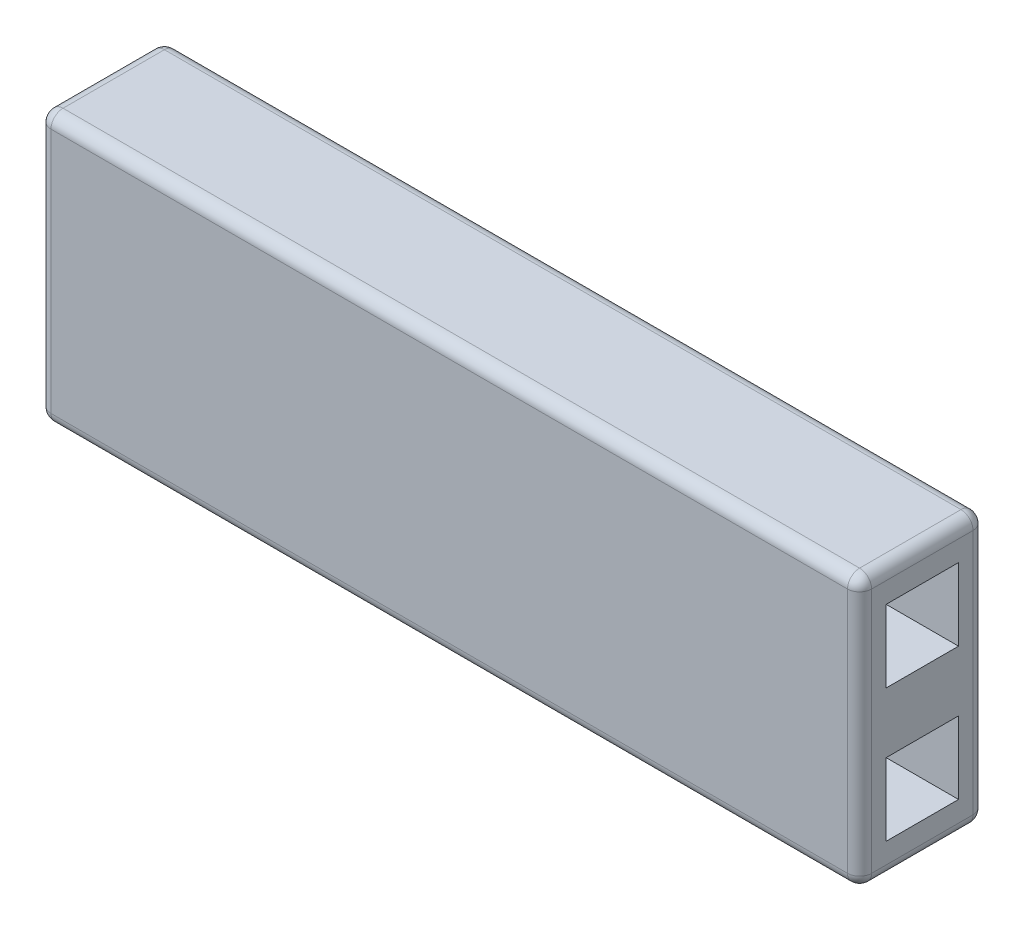
from build123d import *

# Parameters (mm, degrees)
CROQUIS1_W              = 5.6
CROQUIS1_H              = 2.6
SALIENTE_EXTRUIR1_DEPTH = 17
CROQUIS2_W              = 1.5
CROQUIS2_H              = 1.5
CORTAR_EXTRUIR1_DEPTH   = 3
REDONDEO1_R             = 0.25


with BuildPart() as part:
    # Croquis1 → Saliente-Extruir1 (new body)
    with BuildSketch(Plane.YZ):
        Rectangle(CROQUIS1_W, CROQUIS1_H)
    extrude(amount=SALIENTE_EXTRUIR1_DEPTH)

    # Croquis2 → Cortar-Extruir1 (cut)
    with BuildSketch(Plane.YZ.offset(17)):
        with Locations((1.375, 0)):
            Rectangle(CROQUIS2_W, CROQUIS2_H)
        with Locations((-1.375, 0)):
            Rectangle(CROQUIS2_W, CROQUIS2_H)
    extrude(amount=-CORTAR_EXTRUIR1_DEPTH, mode=Mode.SUBTRACT)

    # Redondeo1
    redondeo1_edges = [part.edges().sort_by_distance(p)[0] for p in [
        (17, -2.8, 0),
        (17, 0, -1.3),
        (17, 2.8, 0),
        (0, 0, -1.3),
        (0, -2.8, 0),
        (0, 0, 1.3),
        (0, 2.8, 0),
        (8.5, 2.8, -1.3),
        (8.5, -2.8, -1.3),
        (8.5, -2.8, 1.3),
        (8.5, 2.8, 1.3),
        (17, 0, 1.3),
    ]]
    fillet(redondeo1_edges, radius=REDONDEO1_R)


solid = part.part
